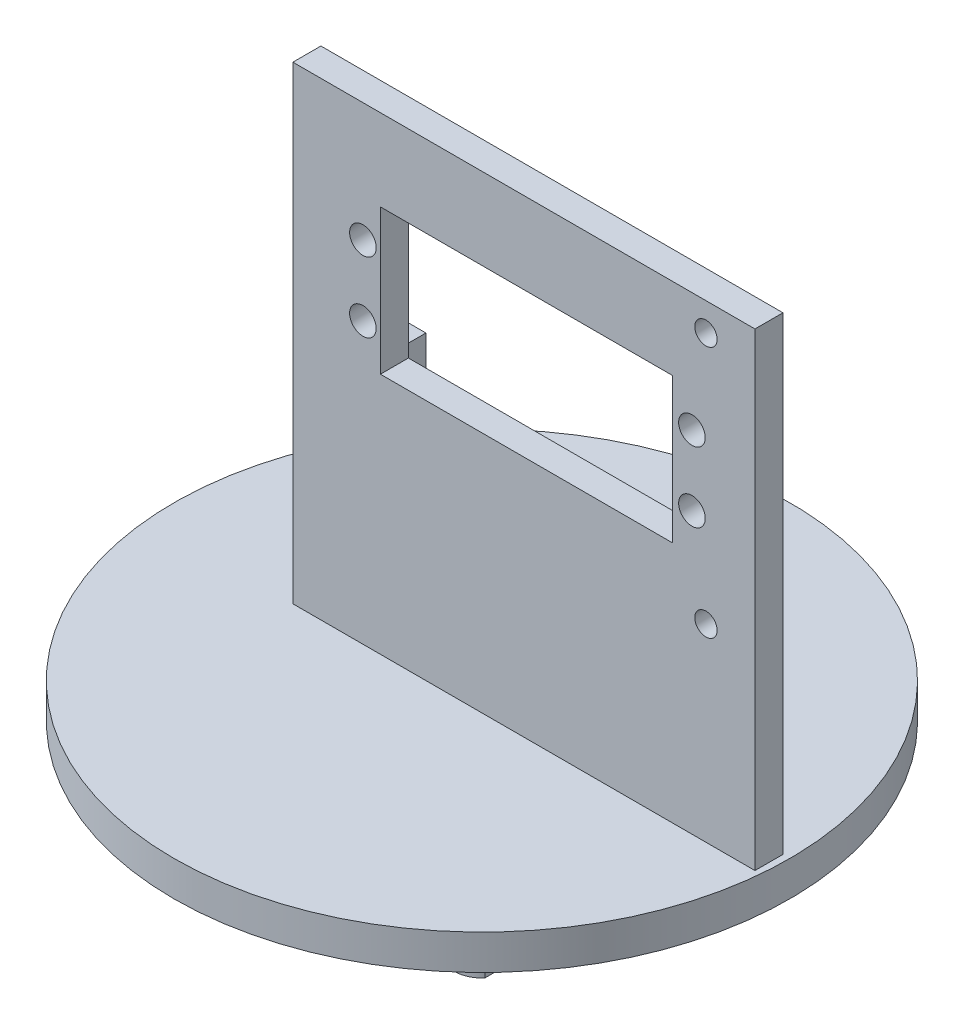
from build123d import *

# Parameters (mm, degrees)
YAW_PLATFORM_START                     = 72
YAW_PLATFORM_PROFILE_R                 = 44
YAW_PLATFORM_DEPTH                     = 5
PRINTED_HOLLOW_YAW_SPINDLE_START       = 43
PRINTED_HOLLOW_YAW_SPINDLE_PROFILE_R   = 3.95
PRINTED_HOLLOW_YAW_SPINDLE_PROFILE_R_2 = 1.75
PRINTED_HOLLOW_YAW_SPINDLE_DEPTH       = 29
INNER_RACE_LOAD_SHOULDER_START         = 70
INNER_RACE_LOAD_SHOULDER_PROFILE_R     = 6
INNER_RACE_LOAD_SHOULDER_PROFILE_R_2   = 1.75
INNER_RACE_LOAD_SHOULDER_DEPTH         = 2
D_FLAT_ON_SPINDLE_END_START            = 43
D_FLAT_DRIVE_KEY_PROFILE_W             = 3
D_FLAT_DRIVE_KEY_PROFILE_H             = 10
D_FLAT_ON_SPINDLE_END_DEPTH            = 5
SHOULDER_MOUNT_PLATE_PROFILE_W         = 66
SHOULDER_MOUNT_PLATE_PROFILE_H         = 68
SHOULDER_MOUNT_PLATE_DEPTH             = 4
MG996_BODY_WINDOW_START                = -5
MG996_BODY_WINDOW_PROFILE_W            = 41.7
MG996_BODY_WINDOW_PROFILE_H            = 20.7
MG996_BODY_WINDOW_DEPTH                = 162.869372409
MG996_TAB_MOUNTS_START                 = -50
MG996_TAB_MOUNTS_PROFILE_R             = 1.9
MG996_TAB_MOUNTS_DEPTH                 = 207.869372409
PASSIVE_SHOULDER_STANDOFFS_START       = -50
PASSIVE_SHOULDER_STANDOFFS_PROFILE_R   = 1.6
PASSIVE_SHOULDER_STANDOFFS_DEPTH       = 207.869372409
UPRIGHT_RIB_START                      = -8
UPRIGHT_RIB_PROFILE_W                  = 7
UPRIGHT_RIB_PROFILE_H                  = 31
UPRIGHT_RIB_DEPTH                      = 12


with BuildPart() as part:
    # Yaw_platform_profile → Yaw_platform (new body)
    with BuildSketch(Plane(origin=(0, 0, 0), x_dir=(1, 0, 0), z_dir=(0, 1, 0)).offset(YAW_PLATFORM_START)):
        with Locations(Location((0, 0, 0), (0, 0, 270))):
            Circle(YAW_PLATFORM_PROFILE_R)
    extrude(amount=YAW_PLATFORM_DEPTH)

    # Printed_hollow_yaw_spindle_profile → Printed_hollow_yaw_spindle (add)
    with BuildSketch(Plane(origin=(0, 0, 0), x_dir=(1, 0, 0), z_dir=(0, 1, 0)).offset(PRINTED_HOLLOW_YAW_SPINDLE_START)):
        with Locations(Location((0, 0, 0), (0, 0, 90))):
            Circle(PRINTED_HOLLOW_YAW_SPINDLE_PROFILE_R)
        with Locations(Location((0, 0, 0), (0, 0, 90))):
            Circle(PRINTED_HOLLOW_YAW_SPINDLE_PROFILE_R_2, mode=Mode.SUBTRACT)
    extrude(amount=PRINTED_HOLLOW_YAW_SPINDLE_DEPTH)

    # Inner_race_load_shoulder_profile → Inner_race_load_shoulder (add)
    with BuildSketch(Plane(origin=(0, 0, 0), x_dir=(1, 0, 0), z_dir=(0, 1, 0)).offset(INNER_RACE_LOAD_SHOULDER_START)):
        with Locations(Location((0, 0, 0), (0, 0, 270))):
            Circle(INNER_RACE_LOAD_SHOULDER_PROFILE_R)
        with Locations(Location((0, 0, 0), (0, 0, 90))):
            Circle(INNER_RACE_LOAD_SHOULDER_PROFILE_R_2, mode=Mode.SUBTRACT)
    extrude(amount=INNER_RACE_LOAD_SHOULDER_DEPTH)

    # D_flat_drive_key_profile → D_flat_on_spindle_end (cut)
    with BuildSketch(Plane(origin=(0, 0, 0), x_dir=(1, 0, 0), z_dir=(0, 1, 0)).offset(D_FLAT_ON_SPINDLE_END_START)):
        with Locations((4.5, 0)):
            Rectangle(D_FLAT_DRIVE_KEY_PROFILE_W, D_FLAT_DRIVE_KEY_PROFILE_H)
    extrude(amount=D_FLAT_ON_SPINDLE_END_DEPTH, mode=Mode.SUBTRACT)

    # Shoulder_mount_plate_profile → Shoulder_mount_plate (add)
    with BuildSketch(Plane.XY):
        with Locations((10, 110)):
            Rectangle(SHOULDER_MOUNT_PLATE_PROFILE_W, SHOULDER_MOUNT_PLATE_PROFILE_H)
    extrude(amount=SHOULDER_MOUNT_PLATE_DEPTH)

    # MG996_body_window_profile → MG996_body_window (cut, through all)
    with BuildSketch(Plane.XY.offset(MG996_BODY_WINDOW_START)):
        with Locations((10.35, 122)):
            Rectangle(MG996_BODY_WINDOW_PROFILE_W, MG996_BODY_WINDOW_PROFILE_H)
    extrude(amount=MG996_BODY_WINDOW_DEPTH, mode=Mode.SUBTRACT)

    # MG996_tab_mounts_profile → MG996_tab_mounts (cut, through all)
    with BuildSketch(Plane.XY.offset(MG996_TAB_MOUNTS_START)):
        with Locations(Location((-13, 117, 0), (0, 0, 180))):
            Circle(MG996_TAB_MOUNTS_PROFILE_R)
        with Locations(Location((-13, 127, 0), (0, 0, 180))):
            Circle(MG996_TAB_MOUNTS_PROFILE_R)
        with Locations(Location((34, 117, 0), (0, 0, 180))):
            Circle(MG996_TAB_MOUNTS_PROFILE_R)
        with Locations(Location((34, 127, 0), (0, 0, 180))):
            Circle(MG996_TAB_MOUNTS_PROFILE_R)
    extrude(amount=MG996_TAB_MOUNTS_DEPTH, mode=Mode.SUBTRACT)

    # Passive_shoulder_standoffs_profile → Passive_shoulder_standoffs (cut, through all)
    with BuildSketch(Plane.XY.offset(PASSIVE_SHOULDER_STANDOFFS_START)):
        with Locations(Location((36, 104, 0), (0, 0, 180))):
            Circle(PASSIVE_SHOULDER_STANDOFFS_PROFILE_R)
        with Locations(Location((36, 140, 0), (0, 0, 180))):
            Circle(PASSIVE_SHOULDER_STANDOFFS_PROFILE_R)
    extrude(amount=PASSIVE_SHOULDER_STANDOFFS_DEPTH, mode=Mode.SUBTRACT)

    # Upright_rib_profile → Upright_rib (add)
    with BuildSketch(Plane.XY.offset(UPRIGHT_RIB_START)):
        with Locations((-19.5, 92.5)):
            Rectangle(UPRIGHT_RIB_PROFILE_W, UPRIGHT_RIB_PROFILE_H)
    extrude(amount=UPRIGHT_RIB_DEPTH)


solid = part.part
